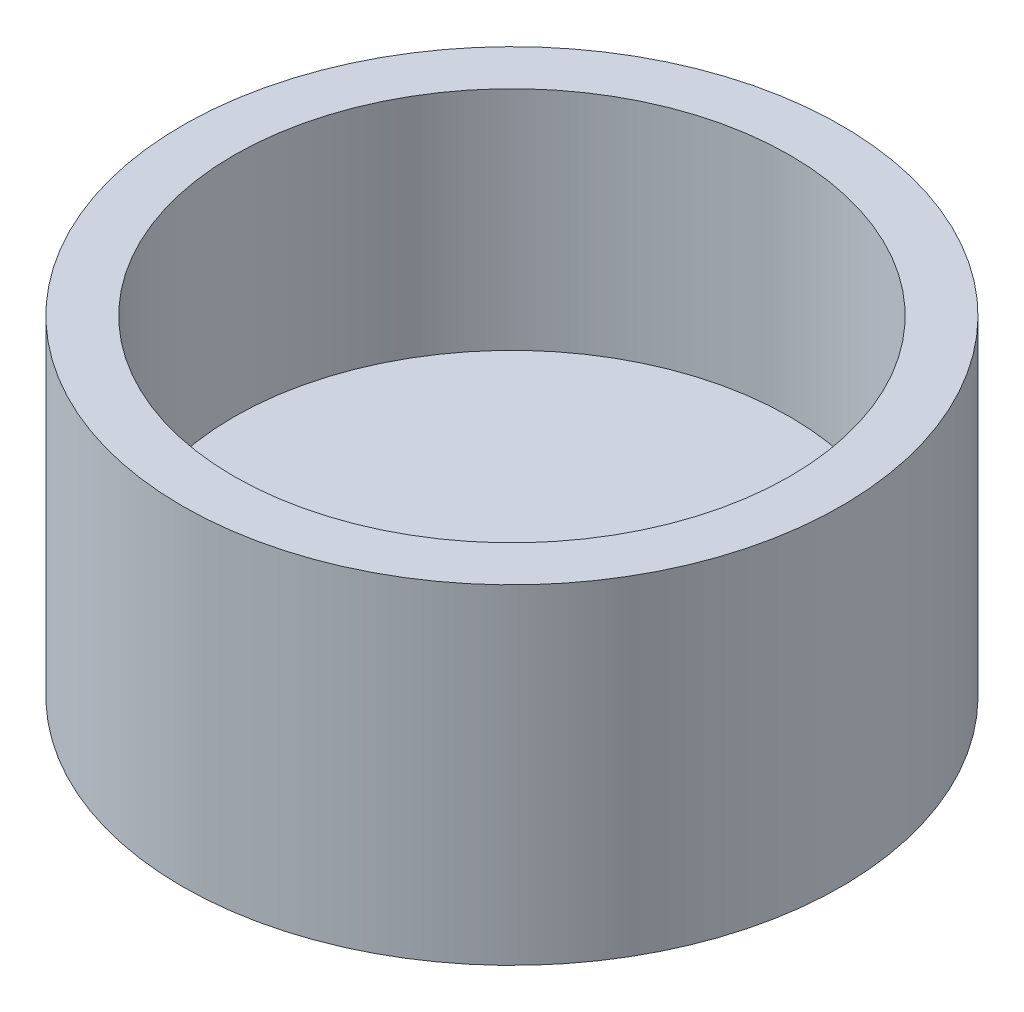
from build123d import *

# Parameters (mm, degrees)
SKETCH1_R           = 16
BOSS_EXTRUDE1_DEPTH = 16
SKETCH2_R           = 13.5
CUT_EXTRUDE1_DEPTH  = 11


with BuildPart() as part:
    # Sketch1 → Boss-Extrude1 (new body)
    with BuildSketch(Plane(origin=(0, 0, 0), x_dir=(1, 0, 0), z_dir=(0, 1, 0))):
        with Locations(Location((0, 0, 0), (0, 0, 270))):
            Circle(SKETCH1_R)
    extrude(amount=BOSS_EXTRUDE1_DEPTH)

    # Sketch2 → Cut-Extrude1 (cut)
    with BuildSketch(Plane(origin=(0, 16, 0), x_dir=(1, 0, 0), z_dir=(0, 1, 0))):
        with Locations(Location((0, 0, 0), (0, 0, 270))):
            Circle(SKETCH2_R)
    extrude(amount=-CUT_EXTRUDE1_DEPTH, mode=Mode.SUBTRACT)


solid = part.part
